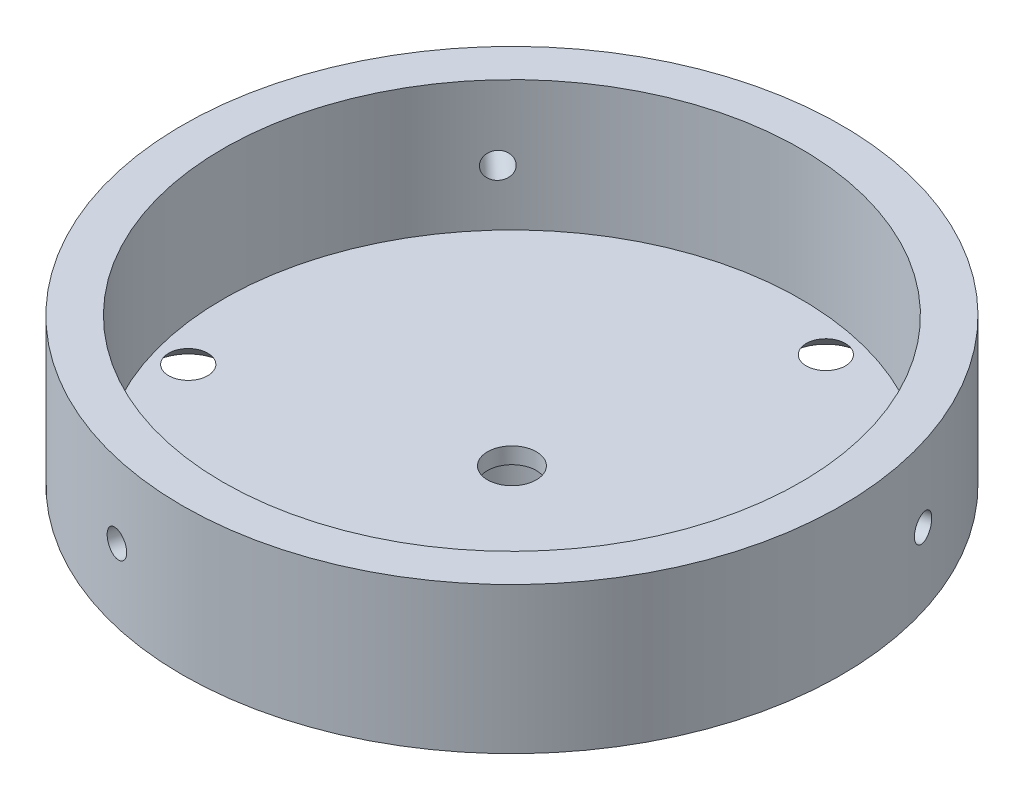
from build123d import *

# Parameters (mm, degrees)
SKETCH1_R           = 20.25
BOSS_EXTRUDE1_DEPTH = 9
SKETCH2_R           = 17.75
CUT_EXTRUDE1_DEPTH  = 8
CIRPATTERN1_COUNT   = 3
SKETCH5_R           = 1.5
CUT_EXTRUDE2_DEPTH  = 8
CIRPATTERN2_COUNT   = 3
SKETCH7_R           = 4.5
BOSS_EXTRUDE3_DEPTH = 4
SKETCH8_R           = 3.265
CUT_EXTRUDE3_DEPTH  = 4


with BuildPart() as part:
    # Sketch1 → Boss-Extrude1 (new body)
    with BuildSketch(Plane(origin=(0, 0, 0), x_dir=(1, 0, 0), z_dir=(0, 1, 0))):
        with Locations(Location((0, 0, 0), (0, 0, 270))):
            Circle(SKETCH1_R)
    extrude(amount=BOSS_EXTRUDE1_DEPTH)

    # Sketch2 → Cut-Extrude1 (cut)
    with BuildSketch(Plane(origin=(0, 9, 0), x_dir=(1, 0, 0), z_dir=(0, 1, 0))):
        with Locations(Location((0, 0, 0), (0, 0, 270))):
            Circle(SKETCH2_R)
    extrude(amount=-CUT_EXTRUDE1_DEPTH, mode=Mode.SUBTRACT)

    # Sketch4 → CSK SLOT for M2 Countersunk Flat Head Screw1 (revolve, cut)
    with BuildSketch(Plane(origin=(11.609715894, 0, 11.00974554), x_dir=(0, 0, -1), z_dir=(1, 0, 0))):
        Polygon((0, 0), (0, 6.521032743), (1.2, 5.8), (1.2, 1), (2.2, 0), align=None)
    csk_slot_for_m2_countersunk_flat_head_sc = revolve(axis=Axis((11.609715894, -6.35, 11.00974554), (0, 1, 0)), mode=Mode.SUBTRACT)

    # CirPattern1: CSK SLOT for M2 Countersunk Flat Head Screw1 ×3 about axis
    cirpattern1_axis = Axis((0, 0, 0), (0, 1, 0))
    for i in range(1, CIRPATTERN1_COUNT):
        add(csk_slot_for_m2_countersunk_flat_head_sc.rotate(cirpattern1_axis, i * 360 / CIRPATTERN1_COUNT), mode=Mode.SUBTRACT)

    # Sketch5 → Cut-Extrude2 (cut)
    with BuildSketch(Plane.XZ):
        with Locations(Location((0, 0, 0), (0, 0, 270))):
            Circle(SKETCH5_R)
    extrude(amount=-CUT_EXTRUDE2_DEPTH, mode=Mode.SUBTRACT)

    # Sketch6 → M2 Tapped Hole1 (revolve, cut)
    with BuildSketch(Plane(origin=(-4.560794248, 4.445790719, 19.729715047), x_dir=(0.974306915892993, 0, 0.22522440729877435), z_dir=(0, 1, 0))):
        Polygon((0, 0), (0, 4.980688495), (0.8, 4.5), (0.8, 0), align=None)
    m2_tapped_hole1 = revolve(axis=Axis((-5.990969234, 4.445790719, 25.916563963), (0.22522440729877433, 0, -0.9743069158929931)), mode=Mode.SUBTRACT)

    # CirPattern2: M2 Tapped Hole1 ×3 about axis
    cirpattern2_axis = Axis((0, 9, 0), (0, -1, 0))
    for i in range(1, CIRPATTERN2_COUNT):
        add(m2_tapped_hole1.rotate(cirpattern2_axis, i * 360 / CIRPATTERN2_COUNT), mode=Mode.SUBTRACT)

    # Sketch7 → Boss-Extrude3 (add)
    with BuildSketch(Plane.XZ):
        with Locations(Location((0, 0, 0), (0, 0, 90))):
            Circle(SKETCH7_R)
    extrude(amount=BOSS_EXTRUDE3_DEPTH)

    # Sketch8 → Cut-Extrude3 (cut)
    with BuildSketch(Plane.XZ.offset(4)):
        with Locations(Location((0, 0, 0), (0, 0, 270))):
            Circle(SKETCH8_R)
    extrude(amount=-CUT_EXTRUDE3_DEPTH, mode=Mode.SUBTRACT)


solid = part.part
